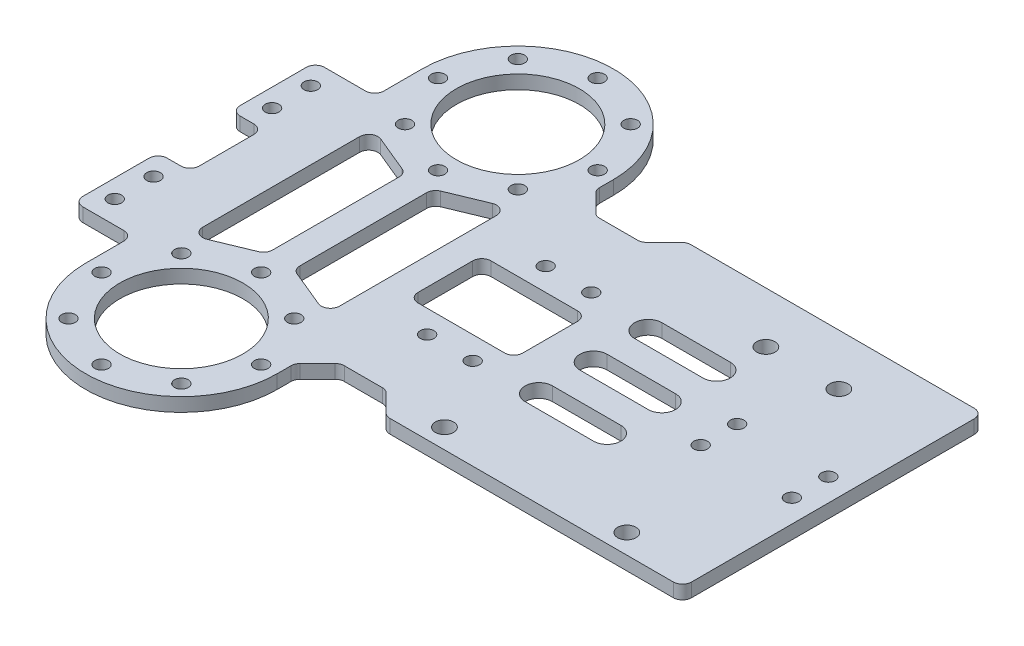
from build123d import *

# Parameters (mm, degrees)
EXTRUDE_1_DEPTH        = 3
SKETCH_2_R             = 1.5
SKETCH_2_R_2           = 13.5
CUT_EXTRUDE_1333_DEPTH = 144.209636547
SKETCH_3_OUTSIDE_W     = 225.27
SKETCH_3_OUTSIDE_H     = 165.27
CUT_EXTRUDE_1_DEPTH    = 144.209636547
SKETCH_5_R             = 1.5
SKETCH_5_R_2           = 2
CUT_EXTRUDE_3_DEPTH    = 121.819741764
SKETCH_4_W             = 7
SKETCH_4_H             = 16
CUT_EXTRUDE_2_DEPTH    = 121.819741764
FILLET_1_R             = 2


with BuildPart() as part:
    # 草图1 → 凸台-拉伸1 (new body)
    with BuildSketch(Plane(origin=(0, 0, 0), x_dir=(1, 0, 0), z_dir=(0, 1, 0))):
        Polygon((-30, 60), (30, 60), (30, 33), (130, 33), (130, -33), (30, -33), (30, -60), (-30, -60), (-30, -30), (-50, -30), (-50, 30), (-30, 30), align=None)
    extrude(amount=EXTRUDE_1_DEPTH)

    # 草图2 → Cut-Extrude 1333 (cut, through all)
    with BuildSketch(Plane(origin=(0, 3, 0), x_dir=(1, 0, 0), z_dir=(0, 1, 0))):
        with Locations(Location((-30, 13, 0), (0, 0, 270))):
            Circle(SKETCH_2_R)
        with Locations(Location((-30, -13, 0), (0, 0, 270))):
            Circle(SKETCH_2_R)
        with Locations(Location((17.5, 36.9, 0), (0, 0, 270))):
            Circle(SKETCH_2_R)
        with Locations(Location((12.374368671, 24.525631329, 0), (0, 0, 270))):
            Circle(SKETCH_2_R)
        with Locations(Location((0, 19.4, 0), (0, 0, 270))):
            Circle(SKETCH_2_R)
        with Locations(Location((-12.374368671, 24.525631329, 0), (0, 0, 270))):
            Circle(SKETCH_2_R)
        with Locations(Location((-17.5, 36.9, 0), (0, 0, 270))):
            Circle(SKETCH_2_R)
        with Locations(Location((-12.374368671, 49.274368671, 0), (0, 0, 270))):
            Circle(SKETCH_2_R)
        with Locations(Location((0, 54.4, 0), (0, 0, 270))):
            Circle(SKETCH_2_R)
        with Locations(Location((12.374368671, 49.274368671, 0), (0, 0, 270))):
            Circle(SKETCH_2_R)
        with Locations(Location((12.374368671, -49.274368671, 0), (0, 0, 90))):
            Circle(SKETCH_2_R)
        with Locations(Location((0, -54.4, 0), (0, 0, 90))):
            Circle(SKETCH_2_R)
        with Locations(Location((-12.374368671, -49.274368671, 0), (0, 0, 90))):
            Circle(SKETCH_2_R)
        with Locations(Location((-17.5, -36.9, 0), (0, 0, 90))):
            Circle(SKETCH_2_R)
        with Locations(Location((-12.374368671, -24.525631329, 0), (0, 0, 90))):
            Circle(SKETCH_2_R)
        with Locations(Location((0, -19.4, 0), (0, 0, 90))):
            Circle(SKETCH_2_R)
        with Locations(Location((12.374368671, -24.525631329, 0), (0, 0, 90))):
            Circle(SKETCH_2_R)
        with Locations(Location((17.5, -36.9, 0), (0, 0, 90))):
            Circle(SKETCH_2_R)
        with Locations(Location((30, 13, 0), (0, 0, 270))):
            Circle(SKETCH_2_R)
        with Locations(Location((40, 13, 0), (0, 0, 270))):
            Circle(SKETCH_2_R)
        with Locations(Location((0, 36.9, 0), (0, 0, 270))):
            Circle(SKETCH_2_R_2)
        with Locations(Location((0, -36.9, 0), (0, 0, 90))):
            Circle(SKETCH_2_R_2)
        with Locations(Location((40, -13, 0), (0, 0, 90))):
            Circle(SKETCH_2_R)
        with Locations(Location((30, -13, 0), (0, 0, 90))):
            Circle(SKETCH_2_R)
        with Locations(Location((-30, 21.5, 0), (0, 0, 270))):
            Circle(SKETCH_2_R)
        with Locations(Location((-30, -21.5, 0), (0, 0, 90))):
            Circle(SKETCH_2_R)
    extrude(amount=-CUT_EXTRUDE_1333_DEPTH, mode=Mode.SUBTRACT)

    # 草图3 outside → 切除-拉伸1 (cut, through all)
    with BuildSketch(Plane(origin=(0, 0, 0), x_dir=(1, 0, 0), z_dir=(0, 1, 0))):
        with Locations((40, 0)):
            Rectangle(SKETCH_3_OUTSIDE_W, SKETCH_3_OUTSIDE_H)
        with BuildLine():
            Line((-21, 36.9), (-21, 26.5))
            Line((-21, 26.5), (-34, 26.5))
            Line((-34, 26.5), (-34, -26.5))
            Line((-34, -26.5), (-21, -26.5))
            Line((-21, -26.5), (-21, -36.9))
            ThreePointArc((-21, -36.9), (0, -57.9), (21, -36.9))
            Line((21, -36.9), (21, -33))
            Line((21, -33), (106, -33))
            Line((106, -33), (106, 33))
            Line((106, 33), (21, 33))
            Line((21, 33), (21, 36.9))
            ThreePointArc((21, 36.9), (0, 57.9), (-21, 36.9))
        make_face(mode=Mode.SUBTRACT)
    extrude(amount=CUT_EXTRUDE_1_DEPTH, mode=Mode.SUBTRACT)

    # 草图5 → 切除-拉伸3 (cut, through all)
    with BuildSketch(Plane(origin=(0, 3, 0), x_dir=(1, 0, 0), z_dir=(0, 1, 0))):
        with Locations(Location((81, 4, 0), (0, 0, 270))):
            Circle(SKETCH_5_R)
        with Locations(Location((101, 4, 0), (0, 0, 270))):
            Circle(SKETCH_5_R)
        with Locations(Location((101, -4, 0), (0, 0, 90))):
            Circle(SKETCH_5_R)
        with Locations(Location((81, -4, 0), (0, 0, 90))):
            Circle(SKETCH_5_R)
        with Locations(Location((69.5, 21.8, 0), (0, 0, 270))):
            Circle(SKETCH_5_R_2)
        with Locations(Location((85.5, 21.8, 0), (0, 0, 270))):
            Circle(SKETCH_5_R_2)
        with Locations(Location((49.5, -28.7, 0), (0, 0, 270))):
            Circle(SKETCH_5_R_2)
        with Locations(Location((89.5, -28.7, 0), (0, 0, 270))):
            Circle(SKETCH_5_R_2)
    extrude(amount=-CUT_EXTRUDE_3_DEPTH, mode=Mode.SUBTRACT)

    # 草图4 → 切除-拉伸2 (cut, through all)
    with BuildSketch(Plane(origin=(0, 3, 0), x_dir=(1, 0, 0), z_dir=(0, 1, 0))):
        Polygon((-15, -20.201242434), (-15, 20.201242434), (-3, 15.230679686), (-3, -15.230679686), align=None)
        with Locations((-30.5, 0)):
            Rectangle(SKETCH_4_W, SKETCH_4_H)
        Polygon((3, 15.230679686), (3, -15.230679686), (15, -20.201242434), (15, 20.201242434), align=None)
        Polygon((21, 33), (26, 28), (36, 28), (41, 33), align=None)
        Polygon((26, -8), (44, -8), (44, 8), (26, 8), (21, 8), (21, -8), align=None)
        Polygon((36, -28), (41, -33), (21, -33), (26, -28), align=None)
        with BuildLine():
            Line((53.5, 15), (68.5, 15))
            ThreePointArc((68.5, 15), (71.5, 12), (68.5, 9))
            Line((68.5, 9), (53.5, 9))
            ThreePointArc((53.5, 9), (50.5, 12), (53.5, 15))
        make_face()
        with BuildLine():
            Line((53.5, 3), (68.5, 3))
            ThreePointArc((68.5, 3), (71.5, 0), (68.5, -3))
            Line((68.5, -3), (53.5, -3))
            ThreePointArc((53.5, -3), (50.5, 0), (53.5, 3))
        make_face()
        with BuildLine():
            Line((53.5, -9), (68.5, -9))
            ThreePointArc((68.5, -9), (71.5, -12), (68.5, -15))
            Line((68.5, -15), (53.5, -15))
            ThreePointArc((53.5, -15), (50.5, -12), (53.5, -9))
        make_face()
    extrude(amount=-CUT_EXTRUDE_2_DEPTH, mode=Mode.SUBTRACT)

    # 圆角1
    fillet_1_edges = [part.edges().sort_by_distance(p)[0] for p in [
        (-21, 1.5, -26.5),
        (-34, 1.5, -26.5),
        (-34, 1.5, 26.5),
        (-21, 1.5, 26.5),
        (21, 1.5, 33),
        (106, 1.5, 33),
        (106, 1.5, -33),
        (21, 1.5, -33),
        (41, 1.5, -33),
        (36, 1.5, -28),
        (26, 1.5, -28),
        (26, 1.5, 28),
        (36, 1.5, 28),
        (41, 1.5, 33),
        (44, 1.5, -8),
        (44, 1.5, 8),
        (21, 1.5, 8),
        (21, 1.5, -8),
        (3, 1.5, -15.230679686),
        (15, 1.5, -20.201242434),
        (15, 1.5, 20.201242434),
        (3, 1.5, 15.230679686),
        (-27, 1.5, -8),
        (-27, 1.5, 8),
        (-34, 1.5, 8),
        (-34, 1.5, -8),
        (-15, 1.5, -20.201242434),
        (-3, 1.5, -15.230679686),
        (-3, 1.5, 15.230679686),
        (-15, 1.5, 20.201242434),
    ]]
    fillet(fillet_1_edges, radius=FILLET_1_R)


solid = part.part
